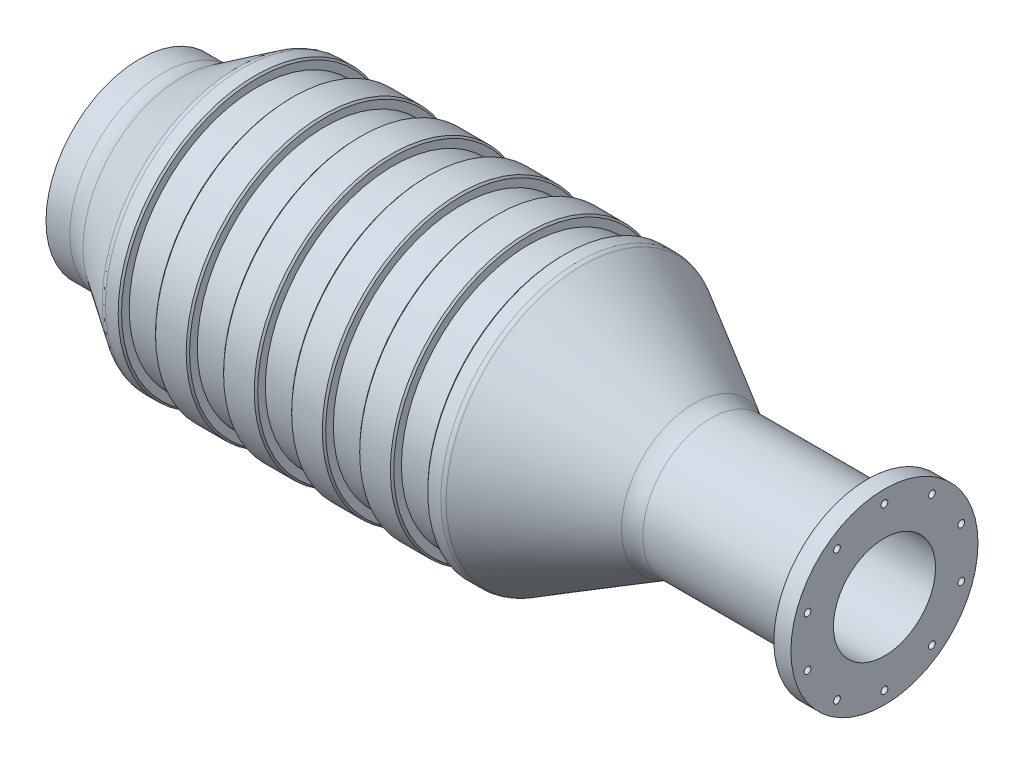
from build123d import *

# Parameters (mm, degrees)
FILLET1_R          = 20
CHAMFER1_SIZE      = 1
FILLET2_R          = 5
SKETCH3_R          = 2
CUT_EXTRUDE2_DEPTH = 10
SKETCH4_R          = 2
CUT_EXTRUDE3_DEPTH = 10
CIRPATTERN2_COUNT  = 10


with BuildPart() as part:
    # Sketch1 → Revolve1 (revolve)
    with BuildSketch(Plane.XY, mode=Mode.PRIVATE) as revolve1_sk:
        with BuildLine():
            Line((227.88151941, 55), (227.88151941, 40))
            Line((227.88151941, 40), (130.530163942, 40))
            Line((130.530163942, 40), (59.107864234, 80.688913326))
            Line((59.107864234, 80.688913326), (49.107864234, 80.688913326))
            Line((49.107864234, 80.688913326), (49.107864234, 75.188913326))
            Line((49.107864234, 75.188913326), (29.107864234, 75.188913326))
            Line((29.107864234, 75.188913326), (29.107864234, 80.688913326))
            Line((29.107864234, 80.688913326), (9.107864234, 80.688913326))
            Line((9.107864234, 80.688913326), (9.107864234, 75.188913326))
            Line((9.107864234, 75.188913326), (-10.892135766, 75.188913326))
            Line((-10.892135766, 75.188913326), (-10.892135766, 80.688913326))
            Line((-10.892135766, 80.688913326), (-30.892135766, 80.688913326))
            Line((-30.892135766, 80.688913326), (-30.892135766, 75.188913326))
            Line((-30.892135766, 75.188913326), (-50.892135766, 75.188913326))
            Line((-50.892135766, 75.188913326), (-50.892135766, 80.688913326))
            Line((-50.892135766, 80.688913326), (-70.892135766, 80.688913326))
            Line((-70.892135766, 80.688913326), (-70.892135766, 75.188913326))
            Line((-70.892135766, 75.188913326), (-90.892135766, 75.188913326))
            Line((-90.892135766, 75.188913326), (-90.892135766, 80.688913326))
            Line((-90.892135766, 80.688913326), (-110.892135766, 80.688913326))
            Line((-110.892135766, 80.688913326), (-110.892135766, 75.188913326))
            Line((-110.892135766, 75.188913326), (-130.892135766, 75.188913326))
            Line((-130.892135766, 75.188913326), (-130.892135766, 80.688913326))
            Line((-130.892135766, 80.688913326), (-140.892135766, 80.688913326))
            Line((-140.892135766, 80.688913326), (-180, 55))
            Line((-180, 55), (-200, 55))
            Line((-200, 55), (-200, 25))
            Line((-200, 25), (-190, 25))
            Line((-190, 25), (-190, 45))
            Line((-190, 45), (-181.186559263, 45))
            ThreePointArc((-181.186559263, 45), (-175.319941263, 45.879780513), (-169.969456882, 48.441720676))
            Line((-169.969456882, 48.441720676), (-140.998524917, 68.067546739))
            ThreePointArc((-140.998524917, 68.067546739), (-135.673537022, 70.62164526), (-129.834772722, 71.509196259))
            Line((-129.834772722, 71.509196259), (54.157835424, 72))
            Line((54.157835424, 72), (127.88151941, 30))
            Line((127.88151941, 30), (237.88151941, 30))
            Line((237.88151941, 30), (237.88151941, 55))
            Line((237.88151941, 55), (227.88151941, 55))
        make_face()
    revolve(revolve1_sk.sketch.rotate(Axis((-200, 0, 0), (1, 0, 0)), 90), axis=Axis((-200, 0, 0), (1, 0, 0)))

    # Fillet1
    fillet1_edges = [part.edges().sort_by_distance(p)[0] for p in [
        (-180, 0, -55),
        (130.530163942, 0, -40),
    ]]
    fillet(fillet1_edges, radius=FILLET1_R)

    # Chamfer1
    chamfer1_edges = [part.edges().sort_by_distance(p)[0] for p in [
        (-130.892135766, 0, -80.688913326),
        (-110.892135766, 0, -80.688913326),
        (-90.892135766, 0, -80.688913326),
        (-70.892135766, 0, -80.688913326),
        (-50.892135766, 0, -80.688913326),
        (-30.892135766, 0, -80.688913326),
        (-10.892135766, 0, -80.688913326),
        (9.107864234, 0, -80.688913326),
        (29.107864234, 0, -80.688913326),
        (49.107864234, 0, -80.688913326),
    ]]
    chamfer(chamfer1_edges, length=CHAMFER1_SIZE)

    # Fillet2
    fillet2_edges = [part.edges().sort_by_distance(p)[0] for p in [
        (-140.892135766, 0, -80.688913326),
        (59.107864234, 0, -80.688913326),
        (227.88151941, 0, -40),
    ]]
    fillet(fillet2_edges, radius=FILLET2_R)

    # Sketch3 → Cut-Extrude2 (cut)
    with BuildSketch(Plane.ZY.offset(200)):
        with Locations((0, 45)):
            Circle(SKETCH3_R)
    cut_extrude2 = extrude(amount=-CUT_EXTRUDE2_DEPTH, mode=Mode.SUBTRACT)

    # Sketch4 → Cut-Extrude3 (cut)
    with BuildSketch(Plane(origin=(237.88151941, 0, 0), x_dir=(0, 0, -1), z_dir=(1, 0, 0))):
        with Locations((0, 47.5)):
            Circle(SKETCH4_R)
    cut_extrude3 = extrude(amount=-CUT_EXTRUDE3_DEPTH, mode=Mode.SUBTRACT)

    # CirPattern2: Cut-Extrude2, Cut-Extrude3 ×10 about axis
    cirpattern2_axis = Axis((0, 0, 0), (1, 0, 0))
    add([cut_extrude2.rotate(cirpattern2_axis, i * 360 / CIRPATTERN2_COUNT) for i in range(1, CIRPATTERN2_COUNT)], mode=Mode.SUBTRACT)
    add([cut_extrude3.rotate(cirpattern2_axis, i * 360 / CIRPATTERN2_COUNT) for i in range(1, CIRPATTERN2_COUNT)], mode=Mode.SUBTRACT)


solid = part.part
